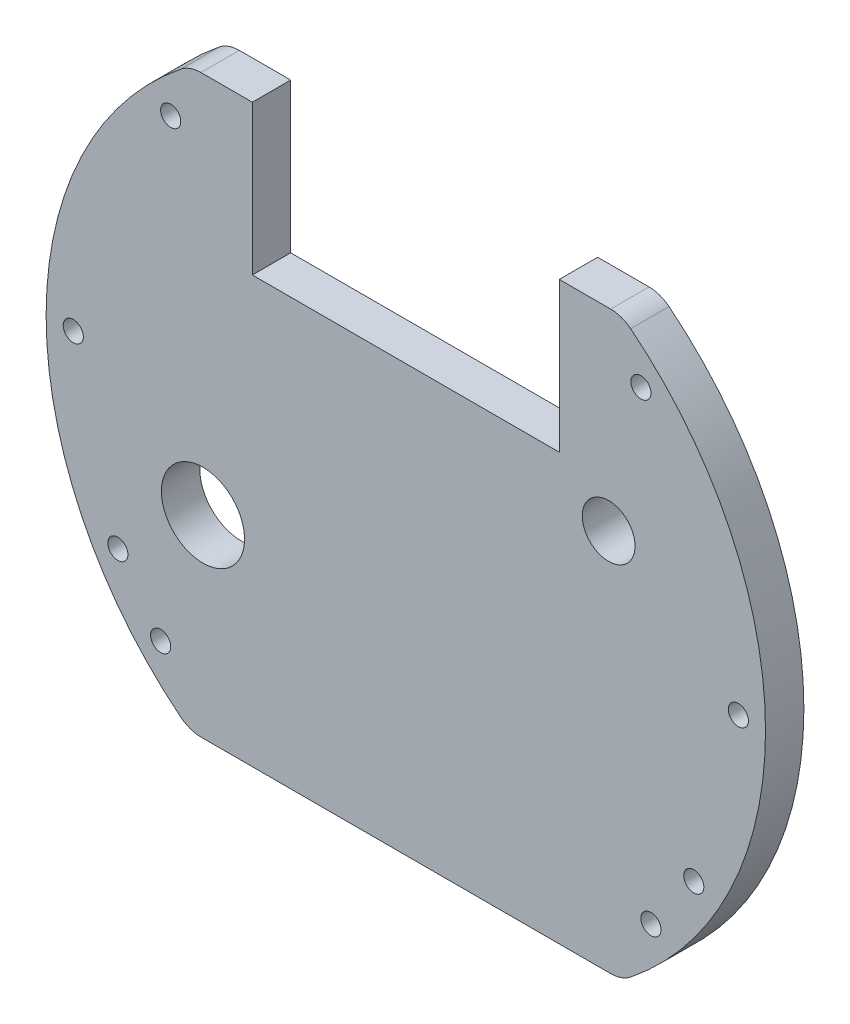
from build123d import *

# Parameters (mm, degrees)
Y_KSEKLIK_EKSTR_ZYON1_DEPTH             = 6
M3X0_5_HELISARMAL_IN_DI_LI_DELIK1_D     = 3.15
M3X0_5_HELISARMAL_IN_DI_LI_DELIK1_DEPTH = 7.5
M3X0_5_HELISARMAL_IN_DI_LI_DELIK1_TIP   = 0.946355475
M8X1_0_HELISARMAL_IN_DI_LI_DELIK2_D     = 8.25
M8X1_0_HELISARMAL_IN_DI_LI_DELIK2_DEPTH = 18
M8X1_0_HELISARMAL_IN_DI_LI_DELIK2_TIP   = 2.478550053
IZIM7_R                                 = 6.5
KES_EKSTR_ZYON1_DEPTH                   = 10


with BuildPart() as part:
    # Çizim1 → Yükseklik-Ekstrüzyon1 (new body)
    with BuildSketch(Plane.XY):
        with BuildLine():
            Line((32.040014045, 45), (24, 45))
            Line((24, 45), (24, 21.6))
            Line((24, 21.6), (-24, 21.6))
            Line((-24, 21.6), (-24, 45))
            Line((-24, 45), (-32.040014045, 45))
            ThreePointArc((-32.040014045, 45), (-33.696486936, 44.717636862), (-35.165869074, 43.902439024))
            ThreePointArc((-35.165869074, 43.902439024), (-56.25, 0), (-35.165869074, -43.902439024))
            ThreePointArc((-35.165869074, -43.902439024), (-33.696486936, -44.717636862), (-32.040014045, -45))
            Line((-32.040014045, -45), (32.040014045, -45))
            ThreePointArc((32.040014045, -45), (33.696486936, -44.717636862), (35.165869074, -43.902439024))
            ThreePointArc((35.165869074, -43.902439024), (56.25, 0), (35.165869074, 43.902439024))
            ThreePointArc((35.165869074, 43.902439024), (33.696486936, 44.717636862), (32.040014045, 45))
        make_face()
    extrude(amount=Y_KSEKLIK_EKSTR_ZYON1_DEPTH)

    # M3x0.5 Helisarmal İçin Dişli Delik1
    with Locations(Plane(origin=(0, 0, 0), x_dir=(-1, 0, 0), z_dir=(0, 0, -1))):
        with Locations((38.338421514, -35.130690796), (52, 0), (-52, 0), (-36.769552622, 36.769552622), (-45.033320997, -26), (36.769552622, 36.769552622), (45.033320997, -26), (-38.338421514, -35.130690796)):
            Hole(M3X0_5_HELISARMAL_IN_DI_LI_DELIK1_D / 2, depth=M3X0_5_HELISARMAL_IN_DI_LI_DELIK1_DEPTH)
            with Locations((0, 0, -(M3X0_5_HELISARMAL_IN_DI_LI_DELIK1_DEPTH + M3X0_5_HELISARMAL_IN_DI_LI_DELIK1_TIP / 2))):  # 118° drill point
                Cone(0, M3X0_5_HELISARMAL_IN_DI_LI_DELIK1_D / 2, M3X0_5_HELISARMAL_IN_DI_LI_DELIK1_TIP, mode=Mode.SUBTRACT)

    # M8x1.0 Helisarmal İçin Dişli Delik2
    with Locations(Plane(origin=(0, 0, 0), x_dir=(-1, 0, 0), z_dir=(0, 0, -1))):
        with Locations((-31.720772546, 14.791639161)):
            Hole(M8X1_0_HELISARMAL_IN_DI_LI_DELIK2_D / 2, depth=M8X1_0_HELISARMAL_IN_DI_LI_DELIK2_DEPTH)
            with Locations((0, 0, -(M8X1_0_HELISARMAL_IN_DI_LI_DELIK2_DEPTH + M8X1_0_HELISARMAL_IN_DI_LI_DELIK2_TIP / 2))):  # 118° drill point
                Cone(0, M8X1_0_HELISARMAL_IN_DI_LI_DELIK2_D / 2, M8X1_0_HELISARMAL_IN_DI_LI_DELIK2_TIP, mode=Mode.SUBTRACT)

    # Çizim7 → Kes-Ekstrüzyon1 (cut)
    with BuildSketch(Plane(origin=(0, 0, 0), x_dir=(-1, 0, 0), z_dir=(0, 0, -1))):
        with Locations((31.720772546, -14.791639161)):
            Circle(IZIM7_R)
    extrude(amount=-KES_EKSTR_ZYON1_DEPTH, mode=Mode.SUBTRACT)


solid = part.part
